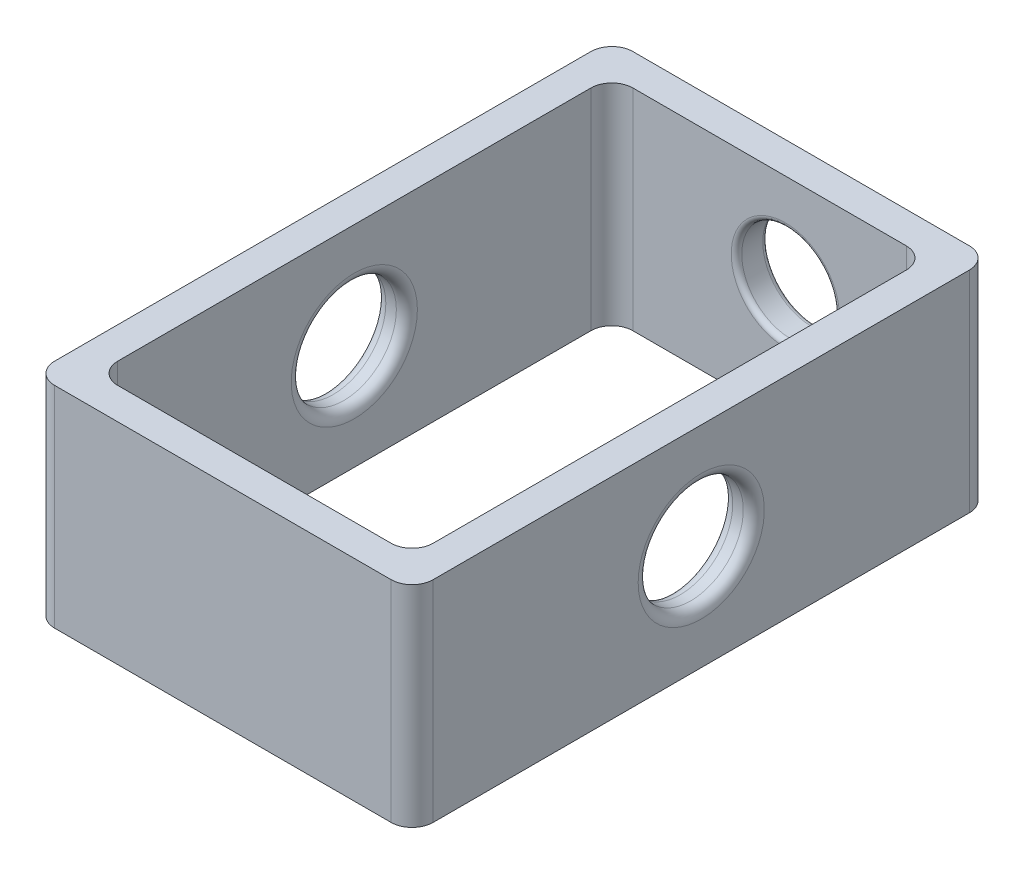
from build123d import *

# Parameters (mm, degrees)
ESBO_O1_W                  = 36
ESBO_O1_H                  = 55
ESBO_O1_W_2                = 30
ESBO_O1_H_2                = 49
SALIENTE_EXTRUIR1_DEPTH    = 10
CORTAR_EXTRUIR4_REACH      = 48.392
CROQUIS8_R                 = 5
REDONDEO1_R                = 2
REDONDEO2_R                = 2
CORTAR_EXTRUIR5_DEPTH      = 59.72818744
CORTAR_EXTRUIR5_DEPTH_BACK = 5
CROQUIS9_R                 = 4.65
REDONDEO5_R                = 0.5
REDONDEO6_R                = 1


with BuildPart() as part:
    # Esboço1 → Saliente-Extruir1 (new, symmetric)
    with BuildSketch(Plane(origin=(0, 0, 0), x_dir=(1, 0, 0), z_dir=(0, 1, 0))):
        Rectangle(ESBO_O1_W, ESBO_O1_H)
        Rectangle(ESBO_O1_W_2, ESBO_O1_H_2, mode=Mode.SUBTRACT)
    extrude(amount=SALIENTE_EXTRUIR1_DEPTH, both=True)

    # Cortar-Extruir4: up to this face of the body (flat: up to its plane)
    cortar_extruir4_end = Plane(part.part.faces().sort_by_distance((18, 0, 0))[0])
    # Croquis8 → Cortar-Extruir4 (cut, up to the picked face)
    with BuildSketch(Plane.ZY.offset(18), mode=Mode.PRIVATE) as cortar_extruir4_sk1:
        Circle(CROQUIS8_R)
    cortar_extruir4_tool1 = split(extrude(cortar_extruir4_sk1.sketch, amount=-CORTAR_EXTRUIR4_REACH, mode=Mode.PRIVATE), bisect_by=cortar_extruir4_end, keep=Keep.BOTH, mode=Mode.PRIVATE)
    add(cortar_extruir4_tool1.solids().sort_by(Axis((-18, 0, 0), (1, 0, 0)))[0], mode=Mode.SUBTRACT)

    # Redondeo1
    redondeo1_edges = [part.edges().sort_by_distance(p)[0] for p in [
        (18, 0, 27.5),
        (-18, 0, 27.5),
        (-18, 0, -27.5),
        (18, 0, -27.5),
    ]]
    fillet(redondeo1_edges, radius=REDONDEO1_R)

    # Redondeo2
    redondeo2_edges = [part.edges().sort_by_distance(p)[0] for p in [
        (-15, 0, -24.5),
        (-15, 0, 24.5),
        (15, 0, 24.5),
        (15, 0, -24.5),
    ]]
    fillet(redondeo2_edges, radius=REDONDEO2_R)

    # Croquis9 → Cortar-Extruir5 (cut, two sides: drawn at the far end of the back side and taken through both)
    with BuildSketch(Plane(origin=(0, 0, -27.5), x_dir=(-1, 0, 0), z_dir=(0, 0, -1)).offset(-CORTAR_EXTRUIR5_DEPTH_BACK)):
        with Locations(Location((-1.5, 1, 0), (0, 0, 180))):
            Circle(CROQUIS9_R)
    extrude(amount=CORTAR_EXTRUIR5_DEPTH + CORTAR_EXTRUIR5_DEPTH_BACK, mode=Mode.SUBTRACT)

    # Redondeo5
    redondeo5_edges = [part.edges().sort_by_distance(p)[0] for p in [
        (-3.15, 1, -24.5),
        (-3.15, 1, -27.5),
    ]]
    fillet(redondeo5_edges, radius=REDONDEO5_R)

    # Redondeo6
    redondeo6_edges = [part.edges().sort_by_distance(p)[0] for p in [
        (15, 0, -5),
        (-15, 0, -5),
        (-18, 0, -5),
        (18, 0, -5),
    ]]
    fillet(redondeo6_edges, radius=REDONDEO6_R)


solid = part.part
